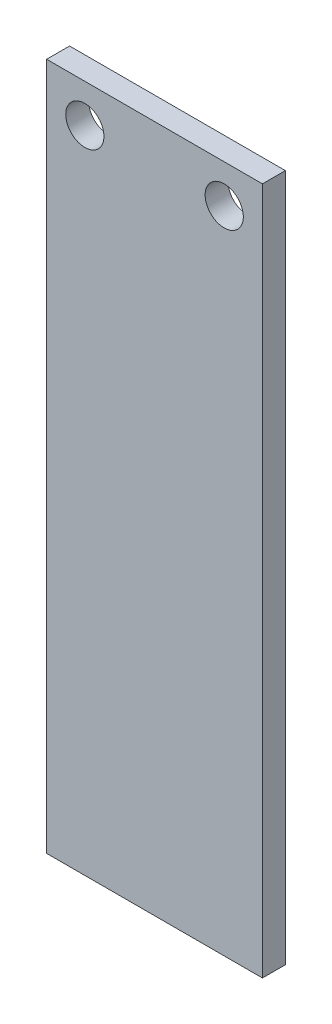
from build123d import *

# Parameters (mm, degrees)
SKETCH1_W           = 28.24
SKETCH1_H           = 80
BOSS_EXTRUDE1_DEPTH = 3
SKETCH3_W           = 28.24
SKETCH3_H           = 10
BOSS_EXTRUDE3_DEPTH = 3
CUT_EXTRUDE1_REACH  = 54.042
SKETCH4_R           = 2.5


with BuildPart() as part:
    # Sketch1 → Boss-Extrude1 (new body)
    with BuildSketch(Plane.XY):
        Rectangle(SKETCH1_W, SKETCH1_H)
    extrude(amount=BOSS_EXTRUDE1_DEPTH)

    # Sketch3 → Boss-Extrude3 (add)
    with BuildSketch(Plane(origin=(0, 0, 0), x_dir=(-1, 0, 0), z_dir=(0, 0, -1))):
        with Locations((0, 45)):
            Rectangle(SKETCH3_W, SKETCH3_H)
    extrude(amount=-BOSS_EXTRUDE3_DEPTH)

    # Sketch4 → Cut-Extrude1 (cut, up to next)
    with BuildSketch(Plane(origin=(0, 0, 0), x_dir=(-1, 0, 0), z_dir=(0, 0, -1)), mode=Mode.PRIVATE) as cut_extrude1_sk1:
        with Locations((9.12, 45)):
            Circle(SKETCH4_R)
    cut_extrude1_tool1 = extrude(cut_extrude1_sk1.sketch, amount=-CUT_EXTRUDE1_REACH, mode=Mode.PRIVATE) & part.part
    cut_extrude1 = cut_extrude1_tool1.solids().sort_by_distance((-9.12, 45, 0))[0]
    add(cut_extrude1, mode=Mode.SUBTRACT)

    # Mirror1: Cut-Extrude1 across plane
    add(cut_extrude1.mirror(Plane(origin=(0, 0, 0), x_dir=(0, 0, 1), z_dir=(1, 0, 0))), mode=Mode.SUBTRACT)


solid = part.part
